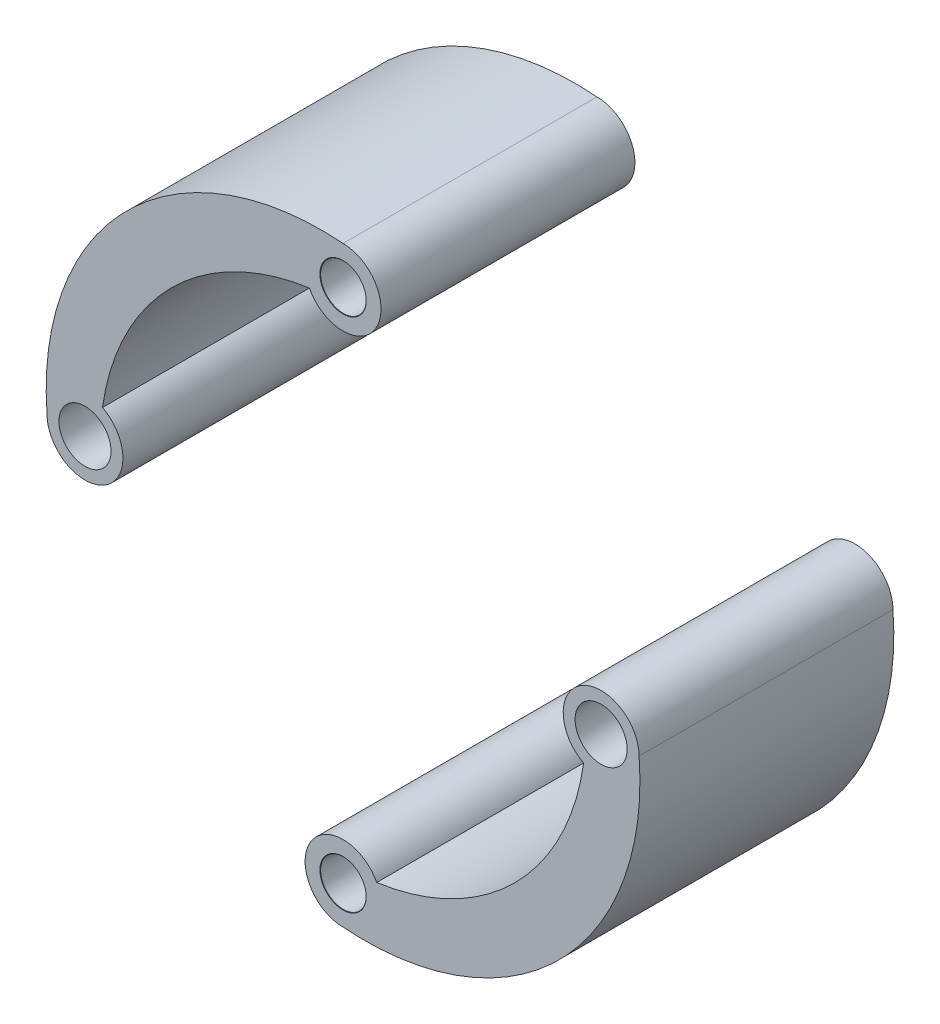
from build123d import *

# Parameters (mm, degrees)
SKETCH1_R                       = 2.5
BOSS_EXTRUDE1_DEPTH             = 16.7224
F_3_0MM_DOWEL_HOLE1_D           = 3
F_3_0MM_DOWEL_HOLE1_CSINK_D     = 3.05
F_3_0MM_DOWEL_HOLE1_CSINK_ANGLE = 100
SKETCH6_R                       = 1.715
CUT_EXTRUDE1_DEPTH              = 5
CUT_EXTRUDE2_START              = -5
SKETCH7_R                       = 1.715
CUT_EXTRUDE2_DEPTH              = 5


with BuildPart() as part:
    # Sketch1 → Boss-Extrude1 (new body)
    with BuildSketch(Plane(origin=(0, 0, 0), x_dir=(0, 1, 0), z_dir=(0, 0, 1))):
        with Locations((0, 17)):
            Circle(SKETCH1_R)
        with BuildLine():
            ThreePointArc((0, 19.5), (1.767766953, 18.767766953), (2.5, 17))
            ThreePointArc((2.5, 17), (2.428349784, 16.405763241), (2.217506139, 15.845588235))
            ThreePointArc((2.217506139, 15.845588235), (11.313708499, 11.313708499), (15.845588235, 2.217506139))
            ThreePointArc((15.845588235, 2.217506139), (18.296913757, 2.137291441), (19.5, 0))
            ThreePointArc((19.5, 0), (14.241833588, 14.241833588), (0, 19.5))
        make_face()
        with Locations((17, 0)):
            Circle(SKETCH1_R)
        with Locations((-17, 0)):
            Circle(SKETCH1_R)
        with Locations((0, -17)):
            Circle(SKETCH1_R)
        with BuildLine():
            ThreePointArc((0, -19.5), (-2.137291441, -18.296913757), (-2.217506139, -15.845588235))
            ThreePointArc((-2.217506139, -15.845588235), (-11.313708499, -11.313708499), (-15.845588235, -2.217506139))
            ThreePointArc((-15.845588235, -2.217506139), (-18.296913757, -2.137291441), (-19.5, 0))
            ThreePointArc((-19.5, 0), (-14.241833588, -14.241833588), (0, -19.5))
        make_face()
    extrude(amount=BOSS_EXTRUDE1_DEPTH)

    # Ø3.0mm Dowel Hole1 (through all)
    with Locations(Plane.XY.offset(16.7224)):
        with Locations((0, 17), (0, -17)):
            CounterSinkHole(F_3_0MM_DOWEL_HOLE1_D / 2, F_3_0MM_DOWEL_HOLE1_CSINK_D / 2, counter_sink_angle=F_3_0MM_DOWEL_HOLE1_CSINK_ANGLE)

    # Sketch6 → Cut-Extrude1 (cut)
    with BuildSketch(Plane.XY.offset(16.7224)):
        with Locations((-17, 0)):
            Circle(SKETCH6_R)
        with Locations((17, 0)):
            Circle(SKETCH6_R)
    extrude(amount=-CUT_EXTRUDE1_DEPTH, mode=Mode.SUBTRACT)

    # Sketch7 → Cut-Extrude2 (cut)
    with BuildSketch(Plane(origin=(0, 0, 0), x_dir=(1, 0, 0), z_dir=(0, 0, -1)).offset(CUT_EXTRUDE2_START)):
        with Locations((-17, 0)):
            Circle(SKETCH7_R)
        with Locations((17, 0)):
            Circle(SKETCH7_R)
    extrude(amount=CUT_EXTRUDE2_DEPTH, mode=Mode.SUBTRACT)


solid = part.part
